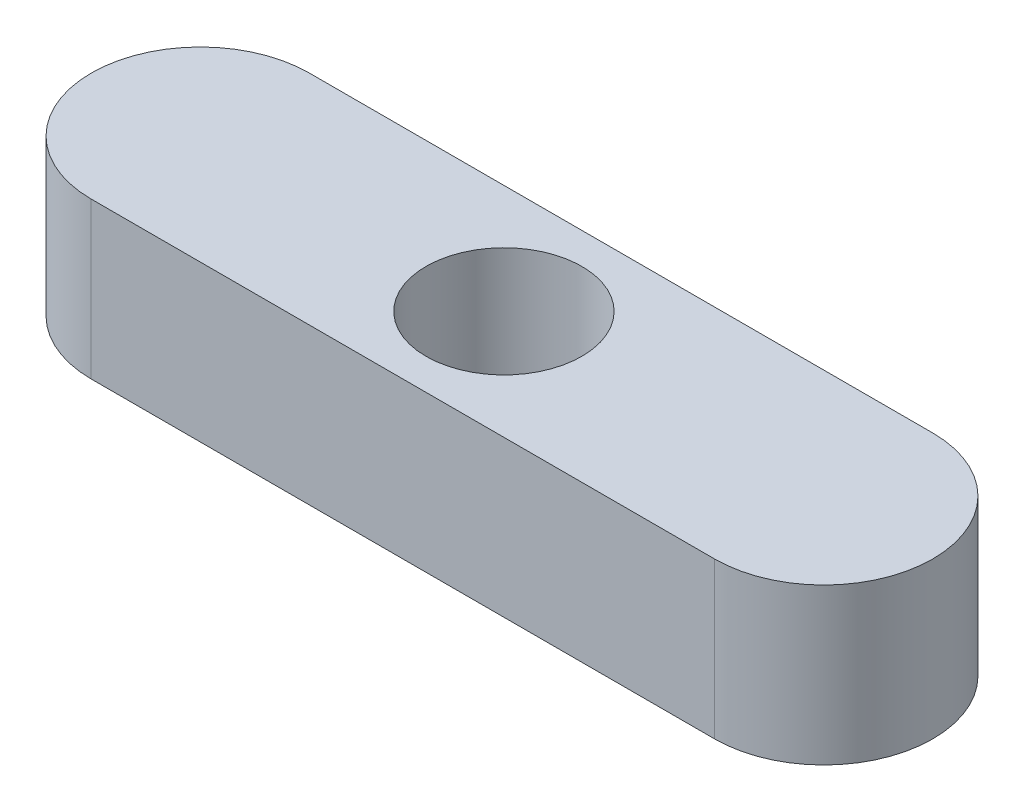
from build123d import *

# Parameters (mm, degrees)
BOSS_EXTRUDE1_DEPTH = 6.35
SKETCH2_R           = 3.175
CUT_EXTRUDE1_DEPTH  = 6.35


with BuildPart() as part:
    # Sketch1 → Boss-Extrude1 (new body)
    with BuildSketch(Plane(origin=(0, 0, 0), x_dir=(1, 0, 0), z_dir=(0, 1, 0))):
        with BuildLine():
            Line((-12.371294118, 5.550647059), (13.028705882, 5.550647059))
            ThreePointArc((13.028705882, 5.550647059), (17.473705882, 1.105647059), (13.028705882, -3.339352941))
            Line((13.028705882, -3.339352941), (-12.371294118, -3.339352941))
            ThreePointArc((-12.371294118, -3.339352941), (-16.816294118, 1.105647059), (-12.371294118, 5.550647059))
        make_face()
    extrude(amount=BOSS_EXTRUDE1_DEPTH)

    # Sketch2 → Cut-Extrude1 (cut)
    with BuildSketch(Plane(origin=(0, 6.35, 0), x_dir=(1, 0, 0), z_dir=(0, 1, 0))):
        with Locations(Location((0, 1.105647059, 0), (0, 0, 270))):
            Circle(SKETCH2_R)
    extrude(amount=-CUT_EXTRUDE1_DEPTH, mode=Mode.SUBTRACT)


solid = part.part
